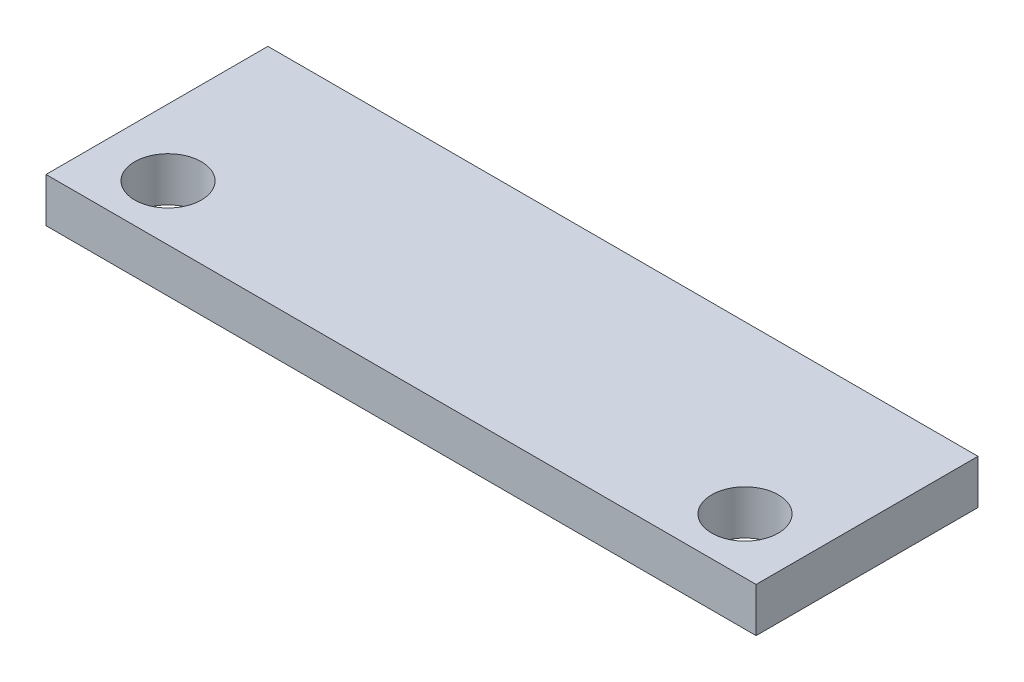
from build123d import *

# Parameters (mm, degrees)
SKETCH1_W           = 32
SKETCH1_H           = 10
SKETCH1_R           = 1.5
BOSS_EXTRUDE1_DEPTH = 2


with BuildPart() as part:
    # Sketch1 → Boss-Extrude1 (new body)
    with BuildSketch(Plane(origin=(0, 0, 0), x_dir=(1, 0, 0), z_dir=(0, 1, 0))):
        Rectangle(SKETCH1_W, SKETCH1_H)
        with Locations(Location((-13, -2.5, 0), (0, 0, 270))):
            Circle(SKETCH1_R, mode=Mode.SUBTRACT)
        with Locations(Location((13, -2.5, 0), (0, 0, 270))):
            Circle(SKETCH1_R, mode=Mode.SUBTRACT)
    extrude(amount=BOSS_EXTRUDE1_DEPTH)


solid = part.part
